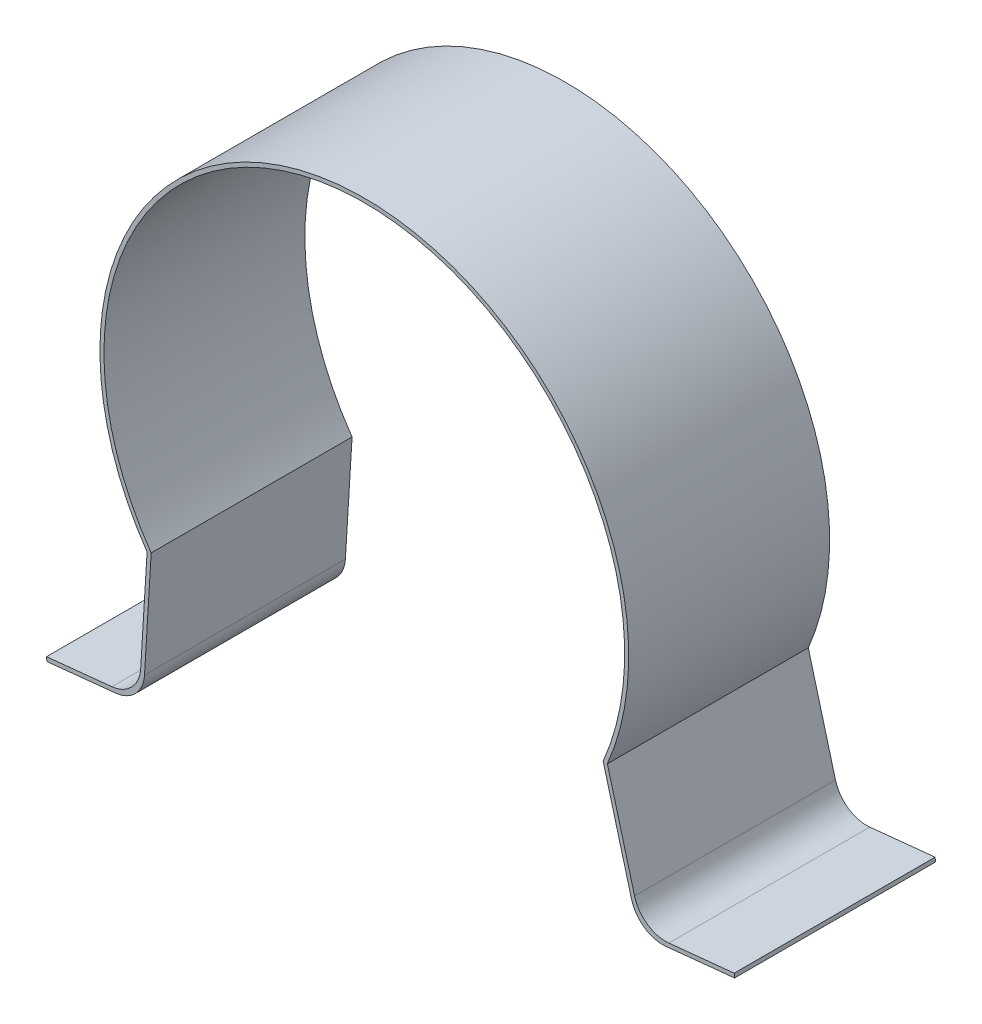
from build123d import *

# Parameters (mm, degrees)
EXTRUDE_1_DEPTH = 25
FILLET_1_R      = 4
FILLET_2_R      = 4
FILLET_3_R      = 4


with BuildPart() as part:
    # Эскиз8 → Вытянуть-Тонкостенный1 (new body)
    with BuildSketch(Plane.XY):
        with BuildLine():
            Line((46.077710984, -28.115556281), (34.138851079, -29.325359636))
            Line((34.138851079, -29.325359636), (29.716592184, -12.910621555))
            ThreePointArc((29.716592184, -12.910621555), (-3.266326095, 32.234936231), (-26.52271954, -18.609281238))
            Line((-26.52271954, -18.609281238), (-27.56062778, -35.57756773))
            Line((-27.56062778, -35.57756773), (-39.498133811, -36.800657979))
            Line((-39.498133811, -36.800657979), (-39.549095905, -36.303261894))
            Line((-39.549095905, -36.303261894), (-28.033783708, -35.123428684))
            Line((-28.033783708, -35.123428684), (-27.032417845, -18.752556771))
            ThreePointArc((-27.032417845, -18.752556771), (-3.316746386, 32.73238753), (30.244682055, -12.948714508))
            Line((30.244682055, -12.948714508), (34.511121689, -28.785075699))
            Line((34.511121689, -28.785075699), (46.027302511, -27.618103785))
            Line((46.027302511, -27.618103785), (46.077710984, -28.115556281))
        make_face()
    extrude(amount=EXTRUDE_1_DEPTH)

    # Скругление1
    fillet_1_edges = [part.edges().sort_by_distance(p)[0] for p in [
        (-28.033783708, -35.123428684, 12.5),
    ]]
    fillet(fillet_1_edges, radius=FILLET_1_R)

    # Скругление2
    fillet_2_edges = [part.edges().sort_by_distance(p)[0] for p in [
        (-27.56062778, -35.57756773, 12.5),
    ]]
    fillet(fillet_2_edges, radius=FILLET_2_R)

    # Скругление3
    fillet_3_edges = [part.edges().sort_by_distance(p)[0] for p in [
        (34.138851079, -29.325359636, 12.5),
        (34.511121689, -28.785075699, 12.5),
    ]]
    fillet(fillet_3_edges, radius=FILLET_3_R)


solid = part.part
